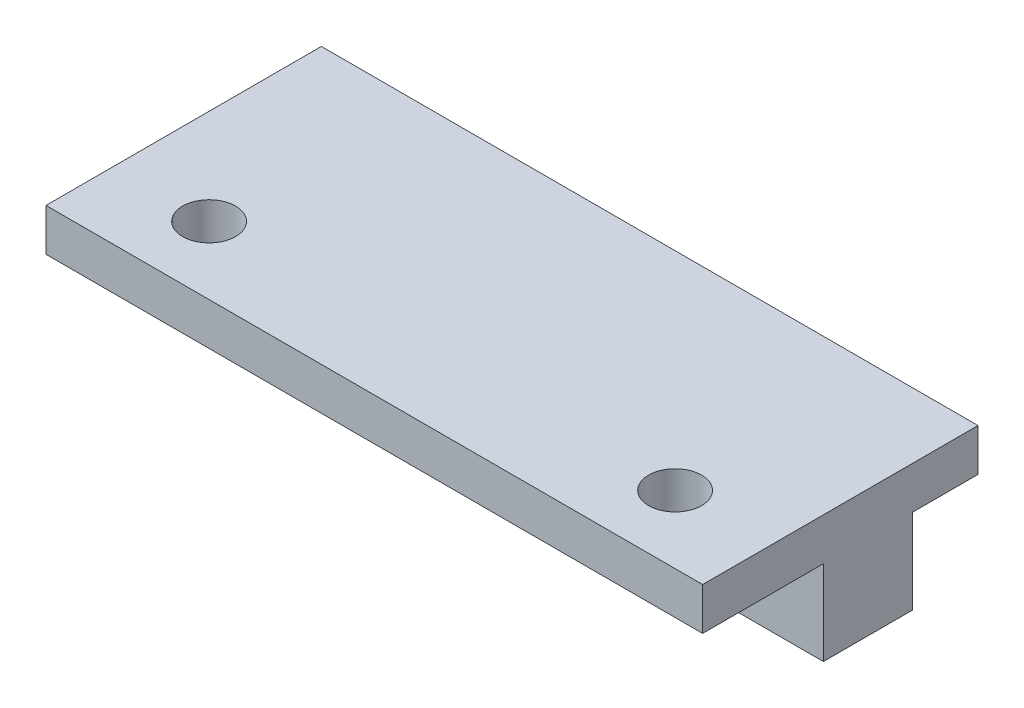
from build123d import *

# Parameters (mm, degrees)
SKETCH1_W           = 31
SKETCH1_H           = 13
SKETCH1_R           = 1.25
BOSS_EXTRUDE1_DEPTH = 2
SKETCH2_W           = 31
SKETCH2_H           = 4.2
SKETCH2_W_2         = 27.6
SKETCH2_H_2         = 2.2
BOSS_EXTRUDE2_DEPTH = 4


with BuildPart() as part:
    # Sketch1 → Boss-Extrude1 (new body)
    with BuildSketch(Plane(origin=(0, 0, 0), x_dir=(1, 0, 0), z_dir=(0, 1, 0))):
        with Locations((15.5, 6.5)):
            Rectangle(SKETCH1_W, SKETCH1_H)
        with Locations(Location((4.5, 3.2, 0), (0, 0, 270))):
            Circle(SKETCH1_R, mode=Mode.SUBTRACT)
        with Locations(Location((26.5, 3.2, 0), (0, 0, 90))):
            Circle(SKETCH1_R, mode=Mode.SUBTRACT)
    extrude(amount=BOSS_EXTRUDE1_DEPTH)

    # Sketch2 → Boss-Extrude2 (add)
    with BuildSketch(Plane.XZ):
        with Locations((15.5, -7.8)):
            Rectangle(SKETCH2_W, SKETCH2_H)
        with Locations((15.5, -7.8)):
            Rectangle(SKETCH2_W_2, SKETCH2_H_2, mode=Mode.SUBTRACT)
    extrude(amount=BOSS_EXTRUDE2_DEPTH)


solid = part.part
